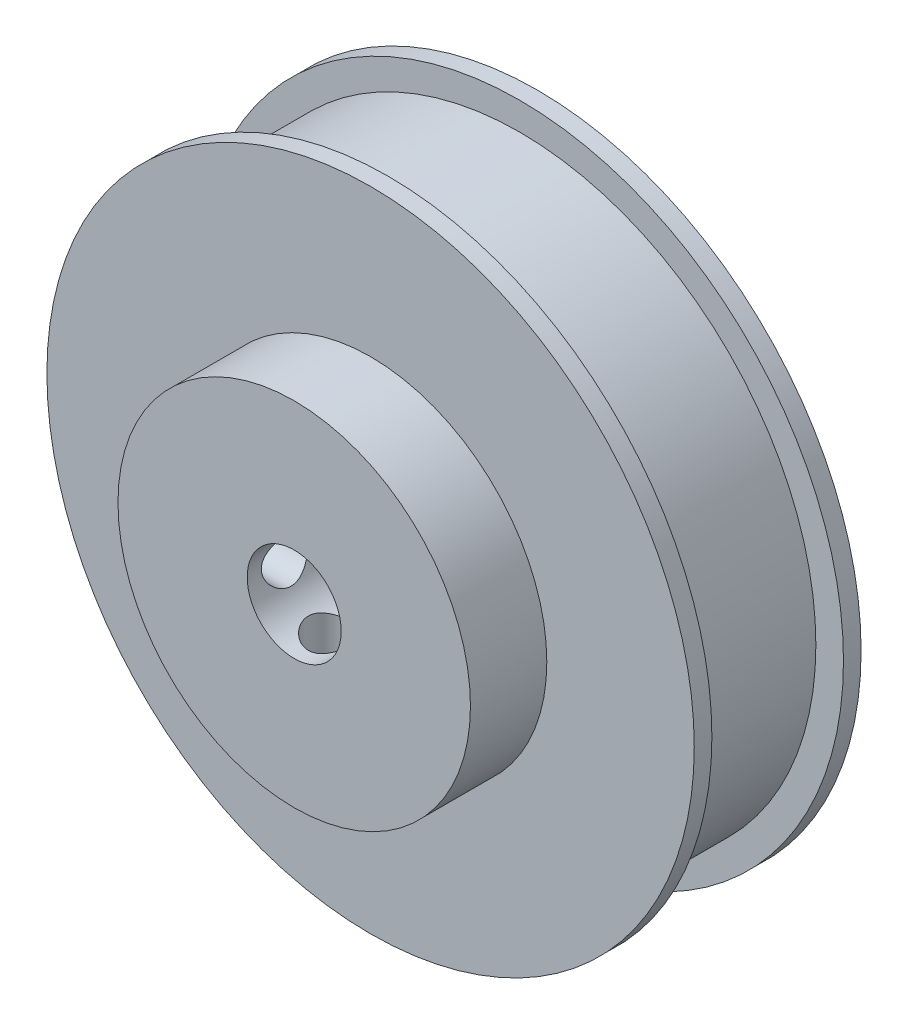
from build123d import *

# Parameters (mm, degrees)
CROQUIS1_R              = 27.55
SALIENTE_EXTRUIR1_DEPTH = 1.5
CROQUIS2_R              = 25.2
SALIENTE_EXTRUIR2_DEPTH = 11.2
CROQUIS3_R              = 27.55
SALIENTE_EXTRUIR3_DEPTH = 1.5
CROQUIS8_R              = 15
SALIENTE_EXTRUIR5_DEPTH = 6.5
CROQUIS6_R              = 2
CORTAR_EXTRUIR3_DEPTH   = 45.119100172
CROQUIS5_R              = 2
CORTAR_EXTRUIR2_DEPTH   = 45.119100219
CROQUIS4_R              = 4
CORTAR_EXTRUIR1_DEPTH   = 45.119100172


with BuildPart() as part:
    # Croquis1 → Saliente-Extruir1 (new body)
    with BuildSketch(Plane.XY):
        Circle(CROQUIS1_R)
    extrude(amount=SALIENTE_EXTRUIR1_DEPTH)

    # Croquis2 → Saliente-Extruir2 (add)
    with BuildSketch(Plane.XY.offset(1.5)):
        Circle(CROQUIS2_R)
    extrude(amount=SALIENTE_EXTRUIR2_DEPTH)

    # Croquis3 → Saliente-Extruir3 (add)
    with BuildSketch(Plane.XY.offset(12.7)):
        Circle(CROQUIS3_R)
    extrude(amount=SALIENTE_EXTRUIR3_DEPTH)

    # Croquis8 → Saliente-Extruir5 (add)
    with BuildSketch(Plane.XY.offset(14.2)):
        with Locations(Location((0, 0, 0), (0, 0, 180))):
            Circle(CROQUIS8_R)
    extrude(amount=SALIENTE_EXTRUIR5_DEPTH)

    # Croquis6 → Cortar-Extruir3 (cut, through all)
    with BuildSketch(Plane(origin=(0, 0, 0), x_dir=(1, 0, 0), z_dir=(0, 1, 0))):
        with Locations(Location((0, -17.5, 0), (0, 0, 270))):
            Circle(CROQUIS6_R)
    extrude(amount=-CORTAR_EXTRUIR3_DEPTH, mode=Mode.SUBTRACT)

    # Croquis5 → Cortar-Extruir2 (cut, through all)
    with BuildSketch(Plane(origin=(0, 0, 0), x_dir=(0, 0, -1), z_dir=(1, 0, 0))):
        with Locations(Location((-17.5, 0, 0), (0, 0, 180))):
            Circle(CROQUIS5_R)
    extrude(amount=-CORTAR_EXTRUIR2_DEPTH, mode=Mode.SUBTRACT)

    # Croquis4 → Cortar-Extruir1 (cut, through all)
    with BuildSketch(Plane.XY.offset(20.7)):
        Circle(CROQUIS4_R)
    extrude(amount=-CORTAR_EXTRUIR1_DEPTH, mode=Mode.SUBTRACT)


solid = part.part
